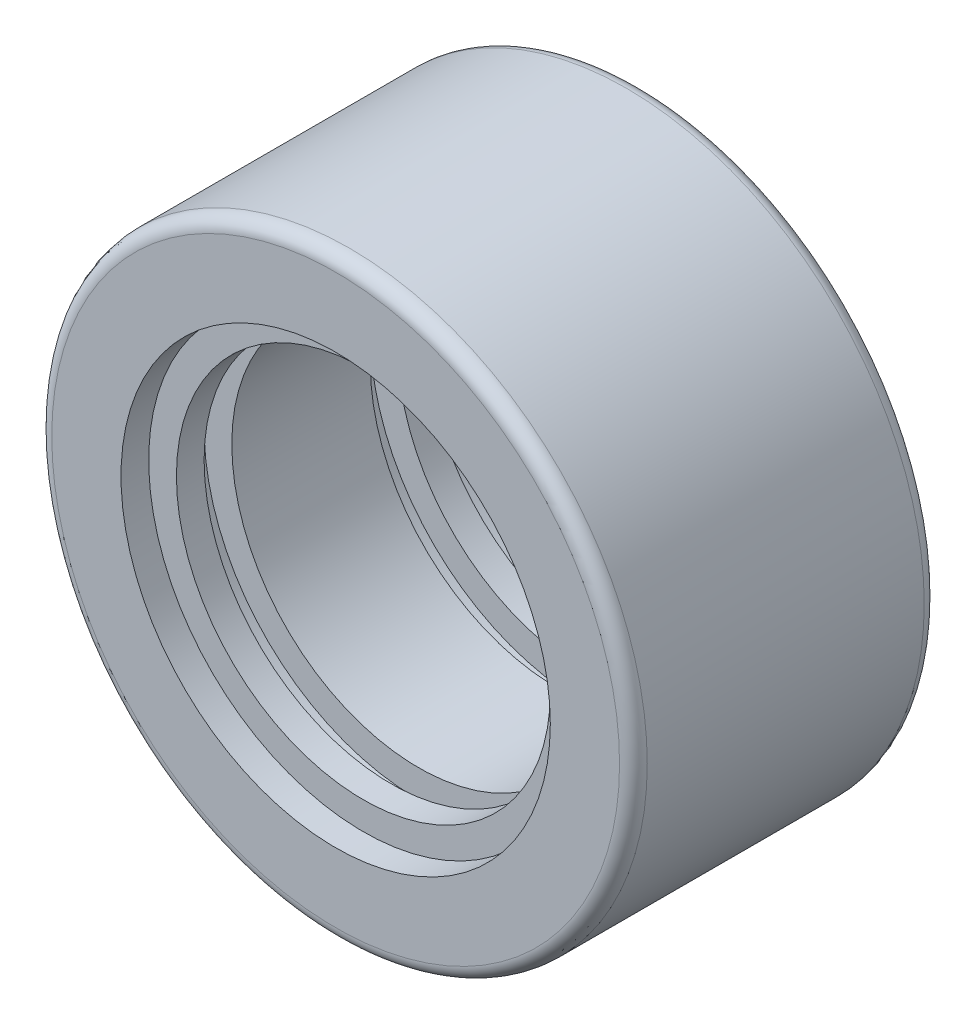
from build123d import *


with BuildPart() as part:
    # Эскиз1 → Повернуть1 (revolve)
    with BuildSketch(Plane(origin=(0, 0, 0), x_dir=(0, 0, -1), z_dir=(1, 0, 0)), mode=Mode.PRIVATE) as revolve_1_sk:
        with BuildLine():
            Line((-10, 21.5), (10, 21.5))
            ThreePointArc((10, 21.5), (10.707106781, 21.207106781), (11, 20.5))
            Line((11, 20.5), (11, 15.5))
            Line((11, 15.5), (9, 15.5))
            Line((9, 15.5), (9, 13.5))
            Line((9, 13.5), (7, 13.5))
            Line((7, 13.5), (7, 15.5))
            Line((7, 15.5), (5, 15.5))
            Line((5, 15.5), (5, 13.5))
            Line((5, 13.5), (-5, 13.5))
            Line((-5, 13.5), (-5, 15.5))
            Line((-5, 15.5), (-7, 15.5))
            Line((-7, 15.5), (-7, 13.5))
            Line((-7, 13.5), (-9, 13.5))
            Line((-9, 13.5), (-9, 15.5))
            Line((-9, 15.5), (-11, 15.5))
            Line((-11, 15.5), (-11, 20.5))
            ThreePointArc((-11, 20.5), (-10.707106781, 21.207106781), (-10, 21.5))
        make_face()
    revolve(revolve_1_sk.sketch.rotate(Axis((0, 0, 20.390367039), (0, 0, -1)), 90), axis=Axis((0, 0, 20.390367039), (0, 0, -1)))


solid = part.part
